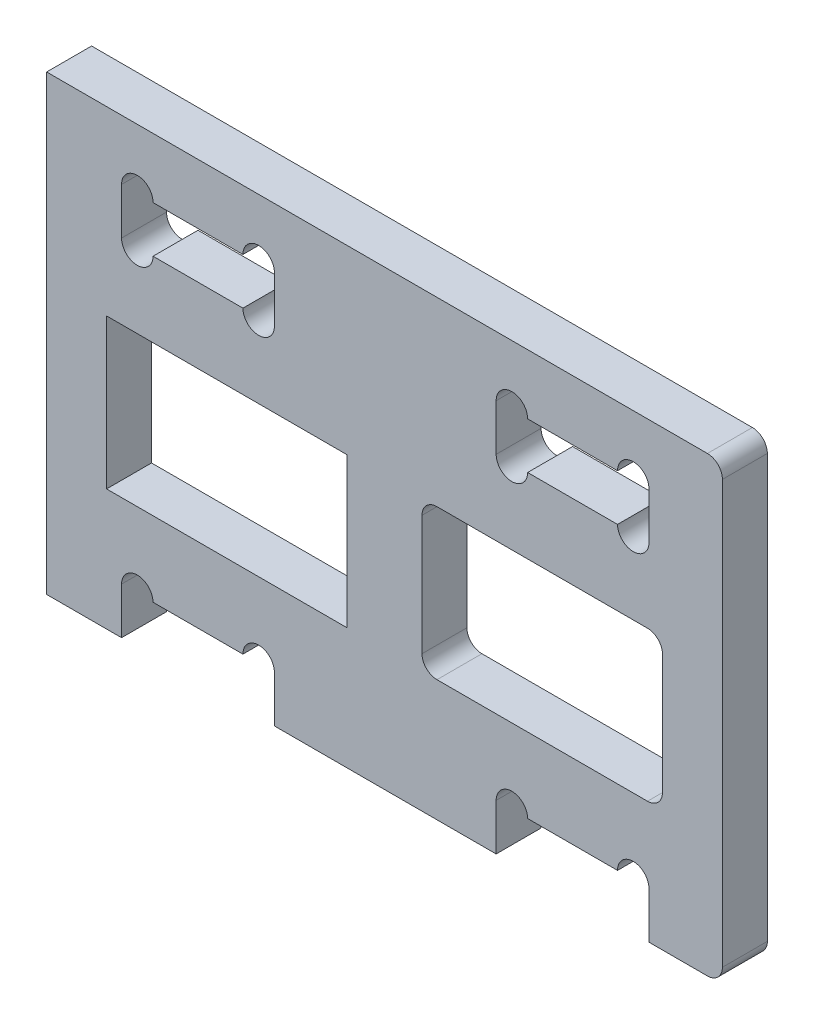
from build123d import *

# Parameters (mm, degrees)
SKETCH_1_W      = 16.05
SKETCH_1_H      = 10
EXTRUDE_1_DEPTH = 3
FILLET_1_R      = 1


with BuildPart() as part:
    # 草图1 → 凸台-拉伸1 (new body)
    with BuildSketch(Plane.XY):
        with BuildLine():
            Line((-5.1, -15.1), (-5.1, -12))
            ThreePointArc((-5.1, -12), (-4.05, -10.95), (-3, -12))
            Line((-3, -12), (3, -12))
            ThreePointArc((3, -12), (4.05, -10.95), (5.1, -12))
            Line((5.1, -12), (5.1, -15.1))
            Line((5.1, -15.1), (10, -15.1))
            Line((10, -15.1), (10, 15.1))
            Line((10, 15.1), (-35.1, 15.1))
            Line((-35.1, 15.1), (-35.1, -15.1))
            Line((-35.1, -15.1), (-30.1, -15.1))
            Line((-30.1, -15.1), (-30.1, -12))
            ThreePointArc((-30.1, -12), (-29.05, -10.95), (-28, -12))
            Line((-28, -12), (-22, -12))
            ThreePointArc((-22, -12), (-20.95, -10.95), (-19.9, -12))
            Line((-19.9, -12), (-19.9, -15.1))
            Line((-19.9, -15.1), (-5.1, -15.1))
        make_face()
        with Locations((-2.025, -2)):
            Rectangle(SKETCH_1_W, SKETCH_1_H, mode=Mode.SUBTRACT)
        with BuildLine():
            Line((3, 8), (-3, 8))
            ThreePointArc((-3, 8), (-4.05, 6.95), (-5.1, 8))
            Line((-5.1, 8), (-5.1, 11.1))
            ThreePointArc((-5.1, 11.1), (-4.05, 12.15), (-3, 11.1))
            Line((-3, 11.1), (3, 11.1))
            ThreePointArc((3, 11.1), (4.05, 12.15), (5.1, 11.1))
            Line((5.1, 11.1), (5.1, 8))
            ThreePointArc((5.1, 8), (4.05, 6.95), (3, 8))
        make_face(mode=Mode.SUBTRACT)
        with BuildLine():
            ThreePointArc((-30.1, 11.1), (-29.05, 12.15), (-28, 11.1))
            Line((-28, 11.1), (-22, 11.1))
            ThreePointArc((-22, 11.1), (-20.95, 12.15), (-19.9, 11.1))
            Line((-19.9, 11.1), (-19.9, 8))
            ThreePointArc((-19.9, 8), (-20.95, 6.95), (-22, 8))
            Line((-22, 8), (-28, 8))
            ThreePointArc((-28, 8), (-29.05, 6.95), (-30.1, 8))
            Line((-30.1, 8), (-30.1, 11.1))
        make_face(mode=Mode.SUBTRACT)
        with Locations((-23.075, -2)):
            Rectangle(SKETCH_1_W, SKETCH_1_H, mode=Mode.SUBTRACT)
    extrude(amount=EXTRUDE_1_DEPTH)

    # 圆角1
    fillet_1_edges = [part.edges().sort_by_distance(p)[0] for p in [
        (6, -7, 1.5),
        (6, 3, 1.5),
        (-10.05, 3, 1.5),
        (-10.05, -7, 1.5),
        (10, 15.1, 1.5),
        (10, -15.1, 1.5),
    ]]
    fillet(fillet_1_edges, radius=FILLET_1_R)


solid = part.part
